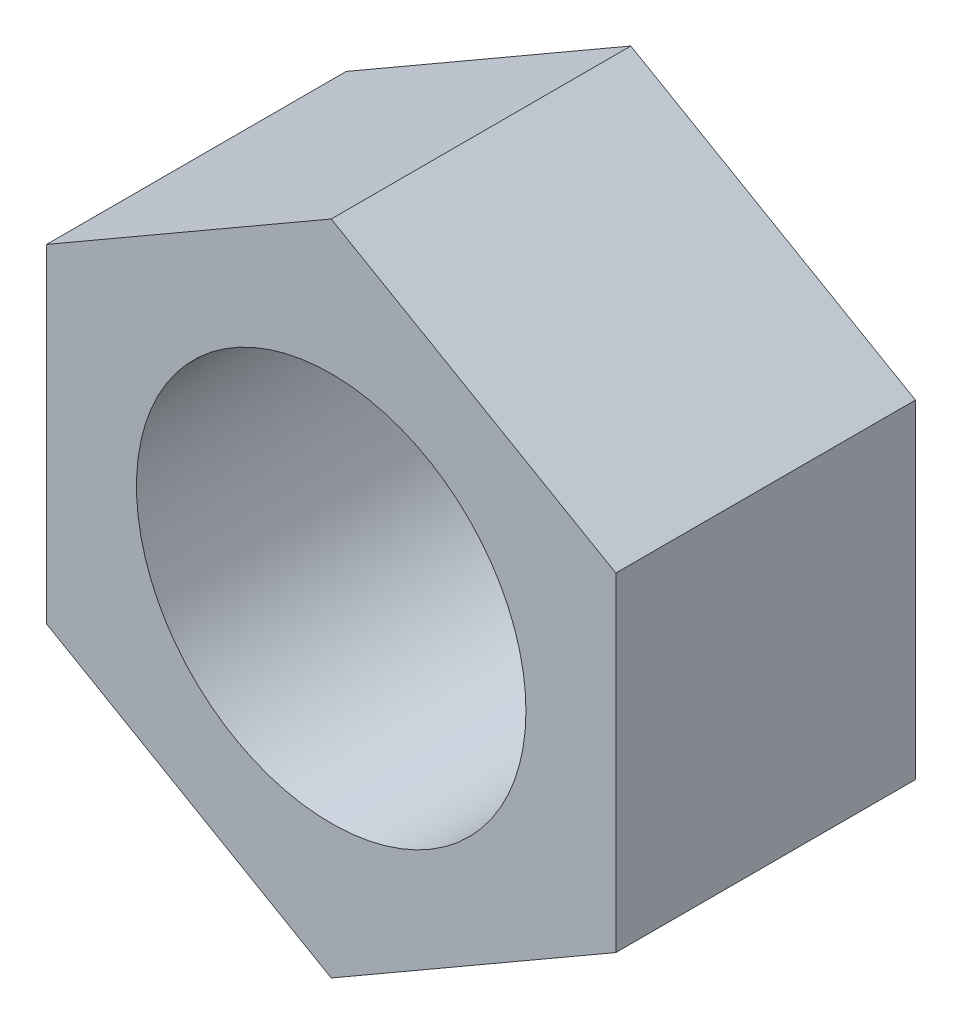
from build123d import *

# Parameters (mm, degrees)
SKETCH1_R           = 3.25
BOSS_EXTRUDE1_DEPTH = 5


with BuildPart() as part:
    # Sketch1 → Boss-Extrude1 (new body)
    with BuildSketch(Plane.XY):
        Polygon((0, 5.484827557), (-4.75, 2.742413779), (-4.75, -2.742413779), (0, -5.484827557), (4.75, -2.742413779), (4.75, 2.742413779), align=None)
        Circle(SKETCH1_R, mode=Mode.SUBTRACT)
    extrude(amount=BOSS_EXTRUDE1_DEPTH)


solid = part.part
